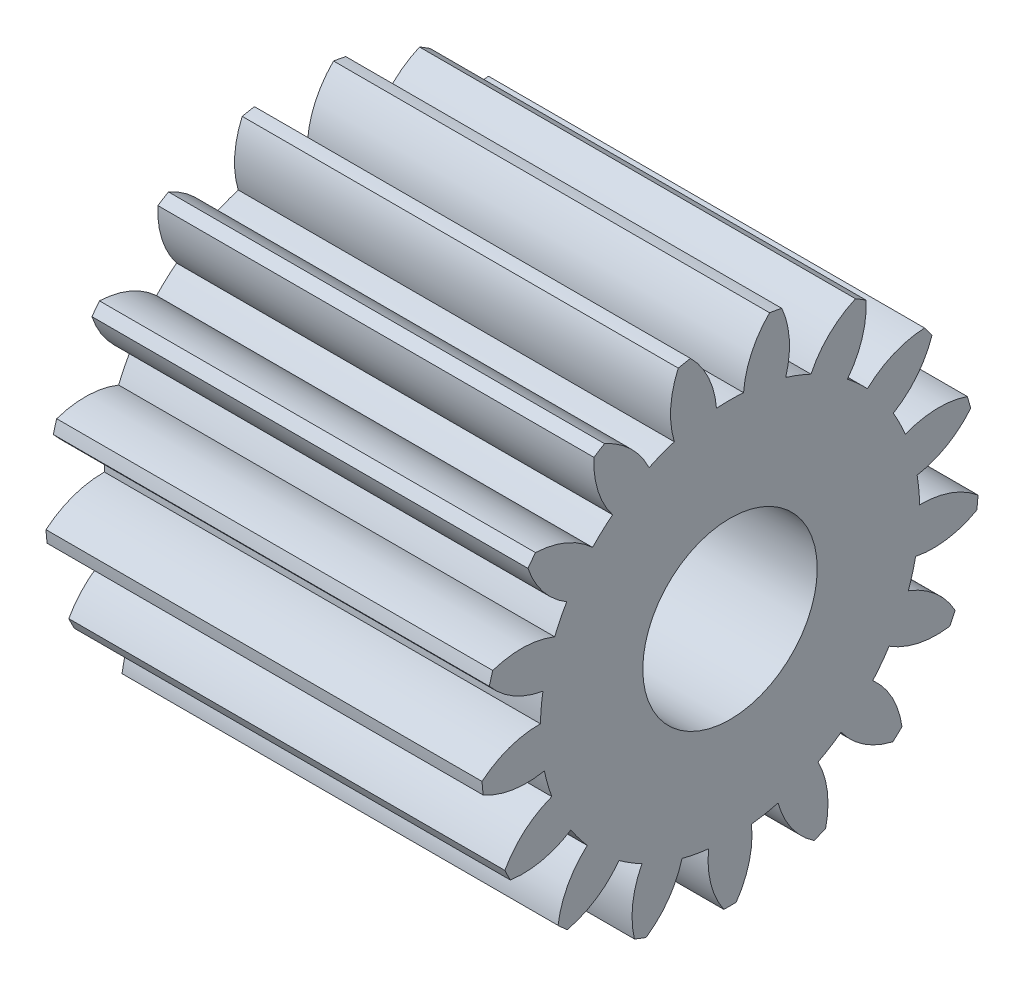
from build123d import *

# Parameters (mm, degrees)
BASPROSKE_W     = 10
BASPROSKE_H     = 5.7
TOOTHCUT_DEPTH  = 13.844454056
TEETHCUTS_COUNT = 17
TEETHCUTS_ANGLE = 338.823529412
BORSKE_R        = 2
BORE_DEPTH      = 50.0000508


with BuildPart() as part:
    # BasProSke → Base-Revolve (revolve)
    with BuildSketch(Plane(origin=(0, 0, 0), x_dir=(1, 0, 0), z_dir=(0, 1, 0)), mode=Mode.PRIVATE) as base_revolve_sk:
        with Locations((5, 2.85)):
            Rectangle(BASPROSKE_W, BASPROSKE_H)
    revolve(base_revolve_sk.sketch.rotate(Axis((-10, 0, 0), (1, 0, 0)), 180), axis=Axis((-10, 0, 0), (1, 0, 0)))

    # TooCutSke → ToothCut (cut, through all)
    with BuildSketch(Plane(origin=(0, 0, 0), x_dir=(0, 0, -1), z_dir=(1, 0, 0))):
        with BuildLine():
            ThreePointArc((0.310384518, 4.337909917), (0, 4.349), (-0.310384518, 4.337909917))
            ThreePointArc((-0.310384518, 4.337909917), (-0.499365984, 5.050550631), (-0.929319613, 5.649475216))
            ThreePointArc((-0.929319613, 5.649475216), (0, 5.7254), (0.929319613, 5.649475216))
            ThreePointArc((0.929319613, 5.649475216), (0.499365984, 5.050550631), (0.310384518, 4.337909917))
        make_face()
    toothcut = extrude(amount=TOOTHCUT_DEPTH, mode=Mode.SUBTRACT)

    # TeethCuts: ToothCut ×17 about axis
    teethcuts_axis = Axis((-10, 0, 0), (1, 0, 0))
    for i in range(1, TEETHCUTS_COUNT):
        add(toothcut.rotate(teethcuts_axis, i * TEETHCUTS_ANGLE / (TEETHCUTS_COUNT - 1)), mode=Mode.SUBTRACT)

    # BorSke → Bore (cut, symmetric)
    with BuildSketch(Plane(origin=(0, 0, 0), x_dir=(0, 0, -1), z_dir=(1, 0, 0))):
        with Locations(Location((0, 0, 0), (0, 0, 180))):
            Circle(BORSKE_R)
    extrude(amount=BORE_DEPTH, both=True, mode=Mode.SUBTRACT)


solid = part.part
